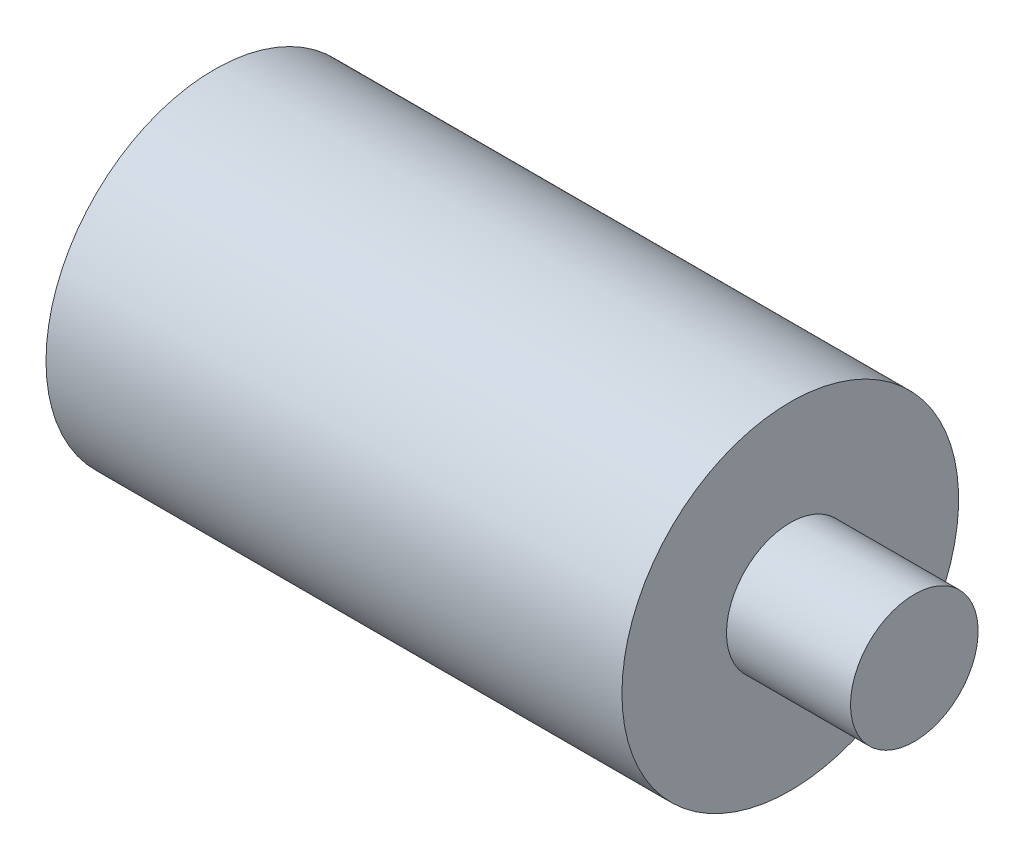
from build123d import *

# Parameters (mm, degrees)
OUTLET_SOCKET_SKETCH_W = 15
OUTLET_SOCKET_SKETCH_H = 10


with BuildPart() as part:
    # Regulator_Ninja Sketch → Regulator_Ninja (revolve)
    with BuildSketch(Plane.XY):
        Polygon((14, 0), (14, 7.2), (0, 7.2), (0, 19), (-65, 19), (-65, 0), align=None)
    revolve(axis=Axis((-1000, 0, 0), (1, 0, 0)))

    # Outlet Socket Sketch → Outlet Socket (revolve, cut)
    with BuildSketch(Plane.XY):
        with Locations((-58.5, 5)):
            Rectangle(OUTLET_SOCKET_SKETCH_W, OUTLET_SOCKET_SKETCH_H)
    revolve(axis=Axis((-1000, 0, 0), (1, 0, 0)), mode=Mode.SUBTRACT)


solid = part.part
